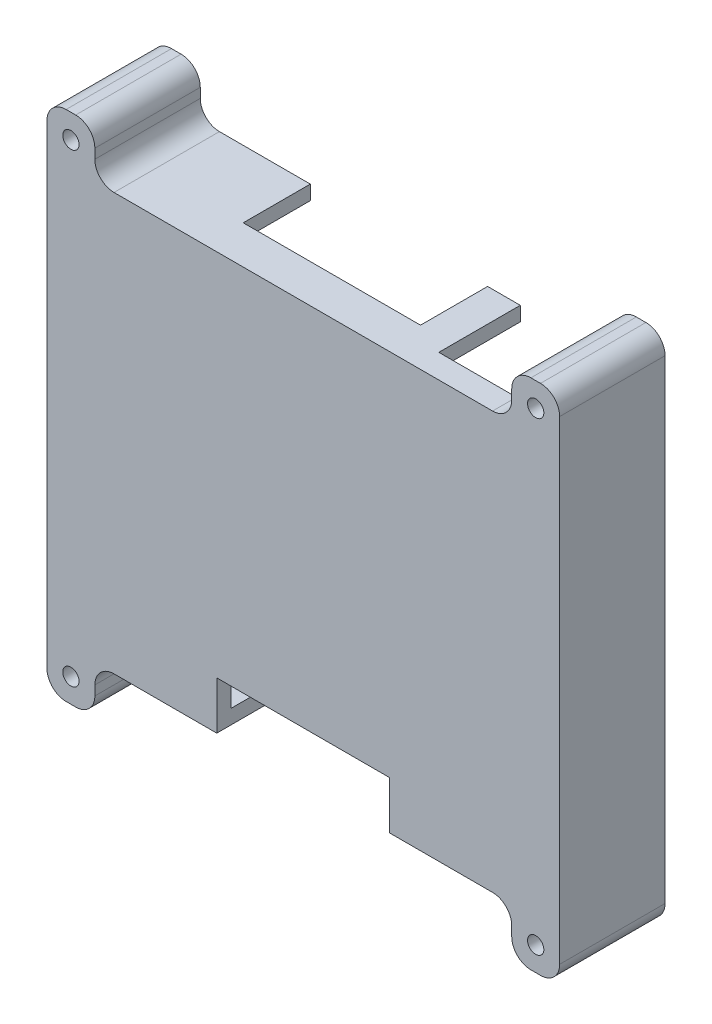
from build123d import *

# Parameters (mm, degrees)
SKETCH1_W                                  = 107
SKETCH1_H                                  = 87
BOSS_EXTRUDE1_DEPTH                        = 22
SKETCH2_W                                  = 10
SKETCH2_H                                  = 10
BOSS_EXTRUDE2_DEPTH                        = 22
MIRROR1_AT_THE_SECOND_PLANE_COPY_1_SKETC_W = 10
MIRROR1_AT_THE_SECOND_PLANE_COPY_1_SKETC_H = 10
MIRROR1_AT_THE_SECOND_PLANE_COPY_1_DEPTH   = 22
SKETCH3_W                                  = 101
SKETCH3_H                                  = 81
CUT_EXTRUDE1_DEPTH                         = 19
M3_CLEARANCE_HOLE1_D                       = 3.4
CUT_EXTRUDE2_REACH                         = 114.939
SKETCH6_W                                  = 16
SKETCH6_H                                  = 17
CUT_EXTRUDE6_REACH                         = 114.939
SKETCH12_W                                 = 16
SKETCH12_H                                 = 17
CUT_EXTRUDE3_REACH                         = 114.939
SKETCH8_W                                  = 37
SKETCH8_H                                  = 14
CUT_EXTRUDE4_REACH                         = 80.794
SKETCH9_W                                  = 36
SKETCH9_H                                  = 10
FILLET1_R                                  = 4
CUT_EXTRUDE5_REACH                         = 114.939
SKETCH11_W                                 = 16
SKETCH11_H                                 = 2
CUT_EXTRUDE5_DIRECTION_2_DEPTH             = 113.939142904


with BuildPart() as part:
    # Sketch1 → Boss-Extrude1 (new body)
    with BuildSketch(Plane.XY):
        Rectangle(SKETCH1_W, SKETCH1_H)
    extrude(amount=BOSS_EXTRUDE1_DEPTH)

    # Sketch2 → Boss-Extrude2 (add)
    with BuildSketch(Plane(origin=(0, 0, 0), x_dir=(-1, 0, 0), z_dir=(0, 0, -1))):
        with Locations((-48.5, -48.5)):
            Rectangle(SKETCH2_W, SKETCH2_H)
    boss_extrude2 = extrude(amount=-BOSS_EXTRUDE2_DEPTH)

    # Mirror1: Boss-Extrude2 across plane
    add(boss_extrude2.mirror(Plane.ZX))

    # Mirror1 at the second plane: Boss-Extrude2 across plane
    add(boss_extrude2.mirror(Plane(origin=(0, 0, 0), x_dir=(0, 0, 1), z_dir=(1, 0, 0))))

    # Mirror1 at the second plane copy 1 sketc → Mirror1 at the second plane copy 1 (add)
    with BuildSketch(Plane(origin=(0, 0, 0), x_dir=(1, 0, 0), z_dir=(0, 0, -1))):
        with Locations((-48.5, -48.5)):
            Rectangle(MIRROR1_AT_THE_SECOND_PLANE_COPY_1_SKETC_W, MIRROR1_AT_THE_SECOND_PLANE_COPY_1_SKETC_H)
    extrude(amount=-MIRROR1_AT_THE_SECOND_PLANE_COPY_1_DEPTH)

    # Sketch3 → Cut-Extrude1 (cut)
    with BuildSketch(Plane(origin=(0, 0, 0), x_dir=(-1, 0, 0), z_dir=(0, 0, -1))):
        Rectangle(SKETCH3_W, SKETCH3_H)
    extrude(amount=-CUT_EXTRUDE1_DEPTH, mode=Mode.SUBTRACT)

    # M3 Clearance Hole1 (through all)
    with Locations(Plane.XY.offset(22)):
        with Locations((-48.5, -48.5), (48.5, -48.5), (48.5, 48.5), (-48.5, 48.5)):
            Hole(M3_CLEARANCE_HOLE1_D / 2)

    # Sketch6 → Cut-Extrude2 (cut, up to next)
    with BuildSketch(Plane.XZ.offset(43.5), mode=Mode.PRIVATE) as cut_extrude2_sk1:
        with Locations((32.284998939, 8.5)):
            Rectangle(SKETCH6_W, SKETCH6_H)
    cut_extrude2_tool1 = extrude(cut_extrude2_sk1.sketch, amount=-CUT_EXTRUDE2_REACH, mode=Mode.PRIVATE) & part.part
    add(cut_extrude2_tool1.solids().sort_by_distance((32.284999, -43.5, 8.5))[0], mode=Mode.SUBTRACT)

    # Sketch12 → Cut-Extrude6 (cut, up to next)
    with BuildSketch(Plane(origin=(0, 43.5, 0), x_dir=(1, 0, 0), z_dir=(0, 1, 0)), mode=Mode.PRIVATE) as cut_extrude6_sk1:
        with Locations((31.284998153, -8.5)):
            Rectangle(SKETCH12_W, SKETCH12_H)
    cut_extrude6_tool1 = extrude(cut_extrude6_sk1.sketch, amount=-CUT_EXTRUDE6_REACH, mode=Mode.PRIVATE) & part.part
    add(cut_extrude6_tool1.solids().sort_by_distance((31.284998, 43.5, 8.5))[0], mode=Mode.SUBTRACT)

    # Sketch8 → Cut-Extrude3 (cut, up to next)
    with BuildSketch(Plane(origin=(0, 43.5, 0), x_dir=(1, 0, 0), z_dir=(0, 1, 0)), mode=Mode.PRIVATE) as cut_extrude3_sk1:
        with Locations((-2.036, -7)):
            Rectangle(SKETCH8_W, SKETCH8_H)
    cut_extrude3_tool1 = extrude(cut_extrude3_sk1.sketch, amount=-CUT_EXTRUDE3_REACH, mode=Mode.PRIVATE) & part.part
    add(cut_extrude3_tool1.solids().sort_by_distance((-2.036, 43.5, 7))[0], mode=Mode.SUBTRACT)

    # Sketch9 → Cut-Extrude4 (cut, up to next)
    with BuildSketch(Plane.XY.offset(22), mode=Mode.PRIVATE) as cut_extrude4_sk1:
        with Locations((-0.055943444, -38.5)):
            Rectangle(SKETCH9_W, SKETCH9_H)
    cut_extrude4_tool1 = extrude(cut_extrude4_sk1.sketch, amount=-CUT_EXTRUDE4_REACH, mode=Mode.PRIVATE) & part.part
    add(cut_extrude4_tool1.solids().sort_by_distance((-0.055943, -38.5, 22))[0], mode=Mode.SUBTRACT)

    # Fillet1
    fillet1_edges = [part.edges().sort_by_distance(p)[0] for p in [
        (43.5, -53.5, 11),
        (43.5, -43.5, 11),
        (53.5, -53.5, 11),
        (-53.5, -53.5, 11),
        (-43.5, -53.5, 11),
        (-43.5, -43.5, 11),
        (53.5, 53.5, 11),
        (43.5, 53.5, 11),
        (43.5, 43.5, 11),
        (-43.5, 53.5, 11),
        (-43.5, 43.5, 11),
        (-53.5, 53.5, 11),
    ]]
    fillet(fillet1_edges, radius=FILLET1_R)

    # Sketch11 → Cut-Extrude5 (cut, up to next)
    with BuildSketch(Plane.XZ.offset(43.5), mode=Mode.PRIVATE) as cut_extrude5_sk1:
        with Locations((-32.249997093, 1)):
            Rectangle(SKETCH11_W, SKETCH11_H)
    cut_extrude5_tool1 = extrude(cut_extrude5_sk1.sketch, amount=-CUT_EXTRUDE5_REACH, mode=Mode.PRIVATE) & part.part
    add(cut_extrude5_tool1.solids().sort_by_distance((-32.249997, -43.5, 1))[0], mode=Mode.SUBTRACT)

    # Sketch11 → Cut-Extrude5 direction 2 (cut)
    with BuildSketch(Plane.XZ.offset(43.5)):
        with Locations((-32.249997093, 1)):
            Rectangle(SKETCH11_W, SKETCH11_H)
    extrude(amount=CUT_EXTRUDE5_DIRECTION_2_DEPTH, mode=Mode.SUBTRACT)


solid = part.part
